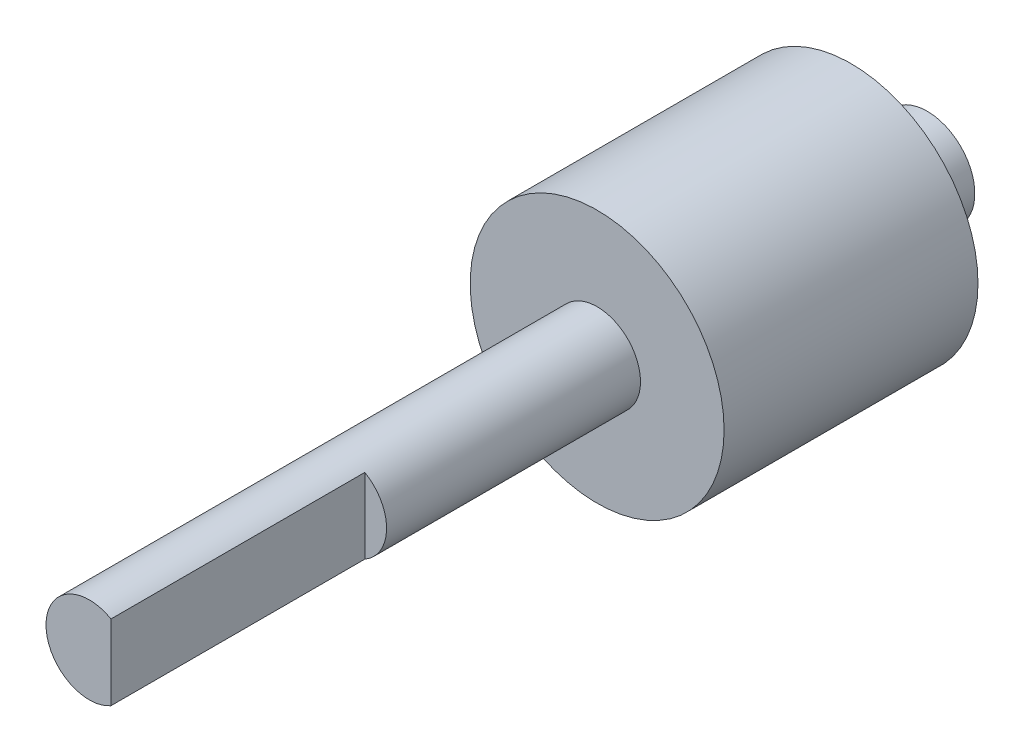
from build123d import *

# Parameters (mm, degrees)
SKETCH1_R           = 5
BOSS_EXTRUDE1_DEPTH = 10
SKETCH2_R           = 1.707
BOSS_EXTRUDE3_DEPTH = 10
BOSS_EXTRUDE4_DEPTH = 10
SKETCH5_R           = 1.875
BOSS_EXTRUDE5_DEPTH = 3


with BuildPart() as part:
    # Sketch1 → Boss-Extrude1 (new body)
    with BuildSketch(Plane.XY):
        with Locations((-12.444444444, 13.922222222)):
            Circle(SKETCH1_R)
    extrude(amount=BOSS_EXTRUDE1_DEPTH)

    # Sketch2 → Boss-Extrude3 (add)
    with BuildSketch(Plane.XY.offset(10)):
        with Locations((-12.444444444, 13.922222222)):
            Circle(SKETCH2_R)
    extrude(amount=BOSS_EXTRUDE3_DEPTH)

    # Sketch4 → Boss-Extrude4 (add)
    with BuildSketch(Plane.XY.offset(20)):
        with BuildLine():
            Line((-11.593886392, 15.402222222), (-11.593886392, 12.442222222))
            ThreePointArc((-11.593886392, 12.442222222), (-14.151444444, 13.922222222), (-11.593886392, 15.402222222))
        make_face()
    extrude(amount=BOSS_EXTRUDE4_DEPTH)

    # Sketch5 → Boss-Extrude5 (add)
    with BuildSketch(Plane(origin=(0, 0, 0), x_dir=(-1, 0, 0), z_dir=(0, 0, -1))):
        with Locations((12.444444444, 13.922222222)):
            Circle(SKETCH5_R)
    extrude(amount=BOSS_EXTRUDE5_DEPTH)


solid = part.part
